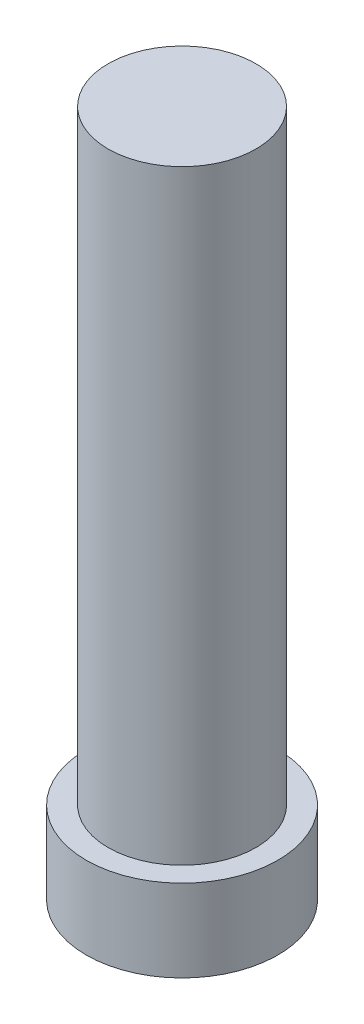
from build123d import *

# Parameters (mm, degrees)
SKETCH2_R           = 3.5
BOSS_EXTRUDE1_DEPTH = 3
SKETCH3_R           = 2.7
BOSS_EXTRUDE2_DEPTH = 22.1


with BuildPart() as part:
    # Sketch2 → Boss-Extrude1 (new body)
    with BuildSketch(Plane(origin=(0, 0, 0), x_dir=(1, 0, 0), z_dir=(0, 1, 0))):
        with Locations(Location((0, 0, 0), (0, 0, 270))):
            Circle(SKETCH2_R)
    extrude(amount=BOSS_EXTRUDE1_DEPTH)

    # Sketch3 → Boss-Extrude2 (add)
    with BuildSketch(Plane(origin=(0, 3, 0), x_dir=(1, 0, 0), z_dir=(0, 1, 0))):
        with Locations(Location((0, 0, 0), (0, 0, 270))):
            Circle(SKETCH3_R)
    extrude(amount=BOSS_EXTRUDE2_DEPTH)


solid = part.part
